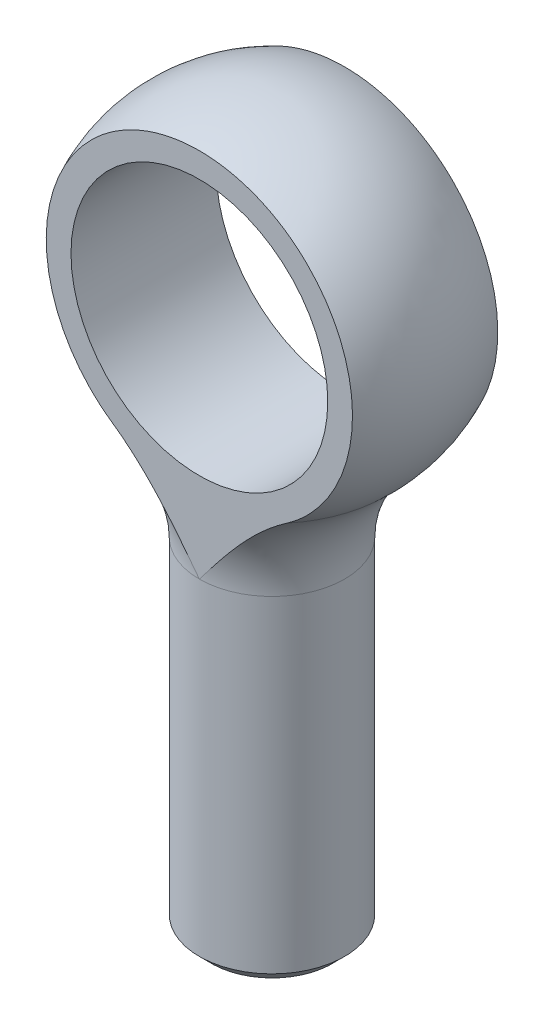
from build123d import *

# Parameters (mm, degrees)
SKETCH1_W               = 9.525
SKETCH1_H               = 44.45
CHAMFER2_SIZE           = 1.5875
CUT_EXTRUDE1_DEPTH      = 60.737268518
CUT_EXTRUDE1_DEPTH_BACK = 60.737268518
SKETCH5_W               = 12.7
SKETCH5_H               = 50.8
CUT_EXTRUDE2_DEPTH      = 57.261143358
CUT_EXTRUDE2_DEPTH_BACK = 57.261143358
SKETCH6_R               = 16.8354375
CUT_EXTRUDE3_DEPTH      = 58.900240514
CUT_EXTRUDE3_DEPTH_BACK = 58.900240514
SKETCH8_W               = 11.1125
SKETCH8_H               = 50.8
CUT_EXTRUDE4_DEPTH      = 58.900240514
CUT_EXTRUDE4_DEPTH_BACK = 58.900240514
SKETCH10_R              = 9.525
CHAMFER1_SIZE           = 0.9525


with BuildPart() as part:
    # Sketch1 → Revolve1 (revolve)
    with BuildSketch(Plane.XY, mode=Mode.PRIVATE) as revolve1_sk:
        with Locations((4.7625, -22.225)):
            Rectangle(SKETCH1_W, SKETCH1_H)
    revolve(revolve1_sk.sketch.rotate(Axis((0, 50.8, 0), (0, -1, 0)), 180), axis=Axis((0, 50.8, 0), (0, -1, 0)))

    # Chamfer2
    chamfer2_edges = [part.edges().sort_by_distance(p)[0] for p in [
        (9.525, -44.45, 0),
    ]]
    chamfer(chamfer2_edges, length=CHAMFER2_SIZE)

    # Sketch4 → Revolve2 (revolve)
    with BuildSketch(Plane.XY):
        with BuildLine():
            Line((9.525, 0), (0, 0))
            Line((0, 0), (0, 50.8))
            ThreePointArc((0, 50.8), (20.743606098, 36.553310038), (14.893041237, 12.078092784))
            ThreePointArc((14.893041237, 12.078092784), (10.927447707, 6.608634352), (9.525, 0))
        make_face()
    revolve(axis=Axis((0, 50.8, 0), (0, 1, 0)))

    # Sketch5 → Cut-Extrude1 (cut, two sides: drawn at the far end of the back side and taken through both)
    with BuildSketch(Plane(origin=(0, 0, 0), x_dir=(0, 0, -1), z_dir=(1, 0, 0)).offset(-CUT_EXTRUDE1_DEPTH_BACK)):
        with Locations((15.875, 25.4)):
            Rectangle(SKETCH5_W, SKETCH5_H)
        with Locations((-15.875, 25.4)):
            Rectangle(SKETCH5_W, SKETCH5_H)
    extrude(amount=CUT_EXTRUDE1_DEPTH + CUT_EXTRUDE1_DEPTH_BACK, mode=Mode.SUBTRACT)

    # Sketch6 → Cut-Extrude2 (cut, two sides: drawn at the far end of the back side and taken through both)
    with BuildSketch(Plane.XY.offset(-CUT_EXTRUDE2_DEPTH_BACK)):
        with Locations((0, 28.575)):
            Circle(SKETCH6_R)
    extrude(amount=CUT_EXTRUDE2_DEPTH + CUT_EXTRUDE2_DEPTH_BACK, mode=Mode.SUBTRACT)


with BuildPart() as body_2:
    # Sketch7 → Revolve3 (revolve)
    with BuildSketch(Plane.XY):
        with BuildLine():
            Line((0, 45.24375), (0, 11.90625))
            ThreePointArc((0, 11.90625), (16.66875, 28.575), (0, 45.24375))
        make_face()
    revolve(axis=Axis((0, 0, 0), (0, 1, 0)))

    # Sketch8 → Cut-Extrude3 (cut, two sides: drawn at the far end of the back side and taken through both)
    with BuildSketch(Plane(origin=(0, 0, 0), x_dir=(0, 0, -1), z_dir=(1, 0, 0)).offset(-CUT_EXTRUDE3_DEPTH_BACK)):
        with Locations((-16.66875, 25.4)):
            Rectangle(SKETCH8_W, SKETCH8_H)
        with Locations((16.66875, 25.4)):
            Rectangle(SKETCH8_W, SKETCH8_H)
    extrude(amount=CUT_EXTRUDE3_DEPTH + CUT_EXTRUDE3_DEPTH_BACK, mode=Mode.SUBTRACT)

    # Sketch10 → Cut-Extrude4 (cut, two sides: drawn at the far end of the back side and taken through both)
    with BuildSketch(Plane.XY.offset(-CUT_EXTRUDE4_DEPTH_BACK)):
        with Locations((0, 28.575)):
            Circle(SKETCH10_R)
    extrude(amount=CUT_EXTRUDE4_DEPTH + CUT_EXTRUDE4_DEPTH_BACK, mode=Mode.SUBTRACT)

    # Chamfer1
    chamfer1_edges = [body_2.edges().sort_by_distance(p)[0] for p in [
        (-9.525, 28.575, -11.1125),
        (-9.525, 28.575, 11.1125),
    ]]
    chamfer(chamfer1_edges, length=CHAMFER1_SIZE)


solid = part.part
